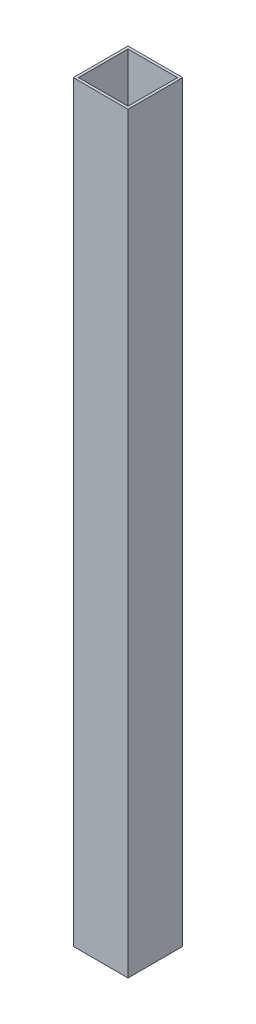
from build123d import *

# Parameters (mm, degrees)
SKETCH2_W           = 25.4
SKETCH2_H           = 25.4
SKETCH2_W_2         = 23
SKETCH2_H_2         = 23
BOSS_EXTRUDE1_DEPTH = 349.2


with BuildPart() as part:
    # Sketch2 → Boss-Extrude1 (new body)
    with BuildSketch(Plane(origin=(0, 0, 0), x_dir=(1, 0, 0), z_dir=(0, 1, 0))):
        Rectangle(SKETCH2_W, SKETCH2_H)
        Rectangle(SKETCH2_W_2, SKETCH2_H_2, mode=Mode.SUBTRACT)
    extrude(amount=BOSS_EXTRUDE1_DEPTH)


solid = part.part
